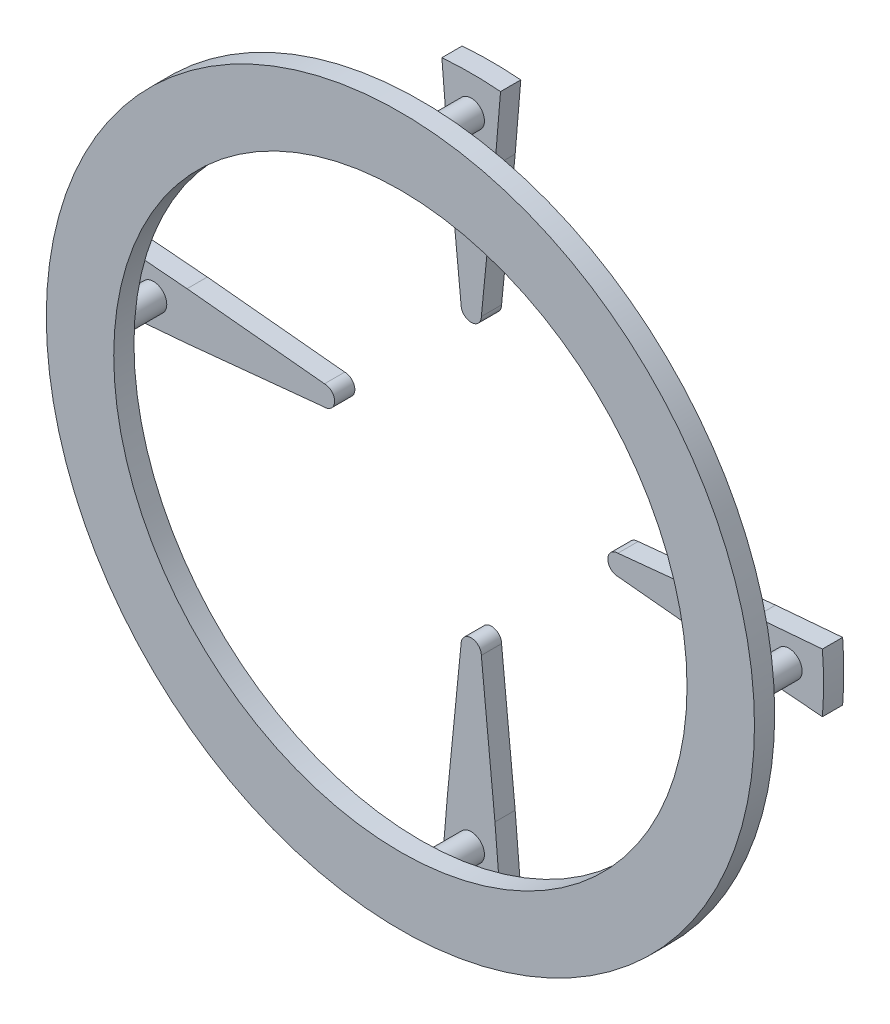
from build123d import *

# Parameters (mm, degrees)
EXTRUDE_1_DEPTH   = 0.06
EXTRUDE_1_2_DEPTH = 0.06
EXTRUDE_1_3_DEPTH = 0.06
EXTRUDE_1_4_DEPTH = 0.06
SKETCH_2_R        = 0.01
EXTRUDE_2_DEPTH   = 0.15
SKETCH_3_R        = 1.05
SKETCH_3_R_2      = 0.85
EXTRUDE_3_DEPTH   = 0.06
SKETCH_6_R        = 0.039268628
SKETCH_6_R_2      = 0.02
EXTRUDE_4_DEPTH   = 0.15


with BuildPart() as part:
    # 草圖1 → 填料-伸長1 (new body)
    with BuildSketch(Plane.XY):
        with BuildLine():
            Line((-0.03, 0.435), (-0.070388149, 0.842515581))
            Line((-0.070388149, 0.842515581), (-0.087001654, 1.041372033))
            ThreePointArc((-0.087001654, 1.041372033), (0, 1.045), (0.087001654, 1.041372033))
            Line((0.087001654, 1.041372033), (0.070388149, 0.842515581))
            Line((0.070388149, 0.842515581), (0.03, 0.435))
            ThreePointArc((0.03, 0.435), (0, 0.405), (-0.03, 0.435))
        make_face()
    extrude(amount=EXTRUDE_1_DEPTH)



with BuildPart() as body_2:
    # 草圖1 → Extrude 1 2 (new body)
    with BuildSketch(Plane.XY):
        with BuildLine():
            Line((0.435, 0.03), (0.842515581, 0.070388149))
            Line((0.842515581, 0.070388149), (1.041372033, 0.087001654))
            ThreePointArc((1.041372033, 0.087001654), (1.045, 0), (1.041372033, -0.087001654))
            Line((1.041372033, -0.087001654), (0.842515581, -0.070388149))
            Line((0.842515581, -0.070388149), (0.435, -0.03))
            ThreePointArc((0.435, -0.03), (0.405, 0), (0.435, 0.03))
        make_face()
    extrude(amount=EXTRUDE_1_2_DEPTH)


with BuildPart() as body_3:
    # 草圖1 → Extrude 1 3 (new body)
    with BuildSketch(Plane.XY):
        with BuildLine():
            Line((0.03, -0.435), (0.070388149, -0.842515581))
            Line((0.070388149, -0.842515581), (0.087001654, -1.041372033))
            ThreePointArc((0.087001654, -1.041372033), (0, -1.045), (-0.087001654, -1.041372033))
            Line((-0.087001654, -1.041372033), (-0.070388149, -0.842515581))
            Line((-0.070388149, -0.842515581), (-0.03, -0.435))
            ThreePointArc((-0.03, -0.435), (0, -0.405), (0.03, -0.435))
        make_face()
    extrude(amount=EXTRUDE_1_3_DEPTH)


with BuildPart() as body_4:
    # 草圖1 → Extrude 1 4 (new body)
    with BuildSketch(Plane.XY):
        with BuildLine():
            Line((-0.435, -0.03), (-0.842515581, -0.070388149))
            Line((-0.842515581, -0.070388149), (-1.041372033, -0.087001654))
            ThreePointArc((-1.041372033, -0.087001654), (-1.045, 0), (-1.041372033, 0.087001654))
            Line((-1.041372033, 0.087001654), (-0.842515581, 0.070388149))
            Line((-0.842515581, 0.070388149), (-0.435, 0.03))
            ThreePointArc((-0.435, 0.03), (-0.405, 0), (-0.435, -0.03))
        make_face()
    extrude(amount=EXTRUDE_1_4_DEPTH)


with BuildPart() as part_1:
    add(part.part)

    add(body_2.part)  # 填料-伸長2 merges body 2

    add(body_3.part)  # 填料-伸長2 merges body 3

    add(body_4.part)  # 填料-伸長2 merges body 4
    # 草圖2 → 填料-伸長2 (add)
    with BuildSketch(Plane.XY.offset(0.06)):
        with Locations((0.941943807, 0)):
            Circle(SKETCH_2_R)
        with Locations((0, 0.941943807)):
            Circle(SKETCH_2_R)
        with Locations((-0.941943807, 0)):
            Circle(SKETCH_2_R)
        with Locations((0, -0.941943807)):
            Circle(SKETCH_2_R)
    extrude(amount=EXTRUDE_2_DEPTH)

    # 草圖3 → 填料-伸長3 (add)
    with BuildSketch(Plane.XY.offset(0.21)):
        Circle(SKETCH_3_R)
        Circle(SKETCH_3_R_2, mode=Mode.SUBTRACT)
    extrude(amount=EXTRUDE_3_DEPTH)

    # 草圖6 → 填料-伸長4 (add)
    # profile 1 of 4: a face of its own
    with BuildSketch(Plane.XY.offset(0.06)):
        with Locations((0.941943807, 0)):
            Circle(SKETCH_6_R)
        with Locations((0.941943807, 0)):
            Circle(SKETCH_6_R_2, mode=Mode.SUBTRACT)
    # profile 2 of 4: a face of its own
    with BuildSketch(Plane.XY.offset(0.06)):
        with Locations((0, -0.941943807)):
            Circle(SKETCH_6_R)
        with Locations((0, -0.941943807)):
            Circle(SKETCH_6_R_2, mode=Mode.SUBTRACT)
    # profile 3 of 4: a face of its own
    with BuildSketch(Plane.XY.offset(0.06)):
        with Locations((-0.941943807, 0)):
            Circle(SKETCH_6_R)
        with Locations((-0.941943807, 0)):
            Circle(SKETCH_6_R_2, mode=Mode.SUBTRACT)
    # profile 4 of 4: a face of its own
    with BuildSketch(Plane.XY.offset(0.06)):
        with Locations((0, 0.941943807)):
            Circle(SKETCH_6_R)
        with Locations((0, 0.941943807)):
            Circle(SKETCH_6_R_2, mode=Mode.SUBTRACT)
    extrude(amount=EXTRUDE_4_DEPTH)


solid = part_1.part
